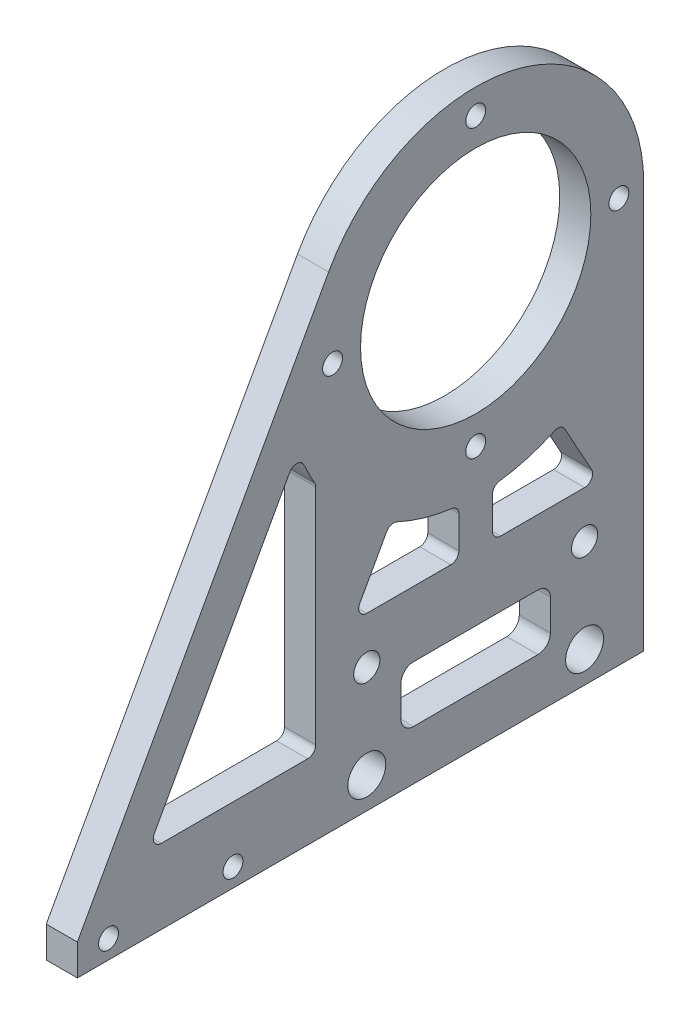
from build123d import *

# Parameters (mm, degrees)
SKETCH_1_R           = 27
SKETCH_1_R_2         = 18.5
EXTRUDE_1_DEPTH      = 5
SKETCH_2_R           = 1.6
CUT_EXTRUDE_1_DEPTH  = 10
EXTRUDE_2_DEPTH      = 5
SKETCH_9_W           = 91
SKETCH_9_H           = 135
CUT_EXTRUDE_5_DEPTH  = 211.049994049
SKETCH_13_R          = 2.1
SKETCH_13_R_2        = 3.0525
CUT_EXTRUDE_6_DEPTH  = 92.356444764
SKETCH_14_R          = 1.6
CUT_EXTRUDE_7_DEPTH  = 92.356444764
SKETCH_15_W          = 24
SKETCH_15_H          = 9
CUT_EXTRUDE_8_DEPTH  = 10
FILLET_1_R           = 2
CUT_EXTRUDE_9_DEPTH  = 92.356444764
FILLET_2_R           = 1.3
CUT_EXTRUDE_10_DEPTH = 92.356444764
FILLET_3_R           = 1.3


with BuildPart() as part:
    # 草图1 → 凸台-拉伸1 (new body)
    with BuildSketch(Plane(origin=(0, 0, 0), x_dir=(0, 0, -1), z_dir=(1, 0, 0))):
        Circle(SKETCH_1_R)
        Circle(SKETCH_1_R_2, mode=Mode.SUBTRACT)
    extrude(amount=EXTRUDE_1_DEPTH)

    # 草图2 → 切除-拉伸1 (cut)
    with BuildSketch(Plane(origin=(5, 0, 0), x_dir=(0, 0, -1), z_dir=(1, 0, 0))):
        with Locations((23, 0)):
            Circle(SKETCH_2_R)
        with Locations((0, -23)):
            Circle(SKETCH_2_R)
        with Locations((0, 23)):
            Circle(SKETCH_2_R)
        with Locations((-23, 0)):
            Circle(SKETCH_2_R)
    extrude(amount=-CUT_EXTRUDE_1_DEPTH, mode=Mode.SUBTRACT)

    # 草图3 → 凸台-拉伸2 (add)
    with BuildSketch(Plane.ZY):
        with BuildLine():
            ThreePointArc((27, 0), (0, -27), (-27, 0))
            Line((-27, 0), (-27, -200))
            Line((-27, -200), (64, -200))
            Line((64, -200), (64, -60))
            Line((64, -60), (23.632414536, 13.057908838))
            ThreePointArc((23.632414536, 13.057908838), (26.144551942, 6.742581388), (27, 0))
        make_face()
    extrude(amount=-EXTRUDE_2_DEPTH)

    # 草图9 → 切除-拉伸5 (cut, through all)
    with BuildSketch(Plane(origin=(5, 0, 0), x_dir=(0, 0, -1), z_dir=(1, 0, 0))):
        with Locations((-18.5, -132.5)):
            Rectangle(SKETCH_9_W, SKETCH_9_H)
    extrude(amount=-CUT_EXTRUDE_5_DEPTH, mode=Mode.SUBTRACT)

    # 草图13 → 切除-拉伸6 (cut, through all)
    with BuildSketch(Plane(origin=(5, 0, 0), x_dir=(0, 0, -1), z_dir=(1, 0, 0))):
        with Locations((-17.5, -45)):
            Circle(SKETCH_13_R)
        with Locations((-17.5, -60)):
            Circle(SKETCH_13_R_2)
        with Locations((17.5, -60)):
            Circle(SKETCH_13_R_2)
        with Locations((17.5, -45)):
            Circle(SKETCH_13_R)
    extrude(amount=-CUT_EXTRUDE_6_DEPTH, mode=Mode.SUBTRACT)

    # 草图14 → 切除-拉伸7 (cut, through all)
    with BuildSketch(Plane.ZY):
        with Locations((39, -62)):
            Circle(SKETCH_14_R)
        with Locations((59, -62)):
            Circle(SKETCH_14_R)
    extrude(amount=-CUT_EXTRUDE_7_DEPTH, mode=Mode.SUBTRACT)

    # 草图15 → 切除-拉伸8 (cut)
    with BuildSketch(Plane.ZY):
        with Locations((0, -52.5)):
            Rectangle(SKETCH_15_W, SKETCH_15_H)
    extrude(amount=-CUT_EXTRUDE_8_DEPTH, mode=Mode.SUBTRACT)

    # 圆角1
    fillet_1_edges = [part.edges().sort_by_distance(p)[0] for p in [
        (2.5, -57, -12),
        (2.5, -48, -12),
        (2.5, -48, 12),
        (2.5, -57, 12),
    ]]
    fillet(fillet_1_edges, radius=FILLET_1_R)

    # 草图16 → 切除-拉伸9 (cut, through all)
    with BuildSketch(Plane(origin=(5, 0, 0), x_dir=(0, 0, -1), z_dir=(1, 0, 0))):
        with BuildLine():
            Line((-28.536090226, -9.256973298), (-52.705963097, -53))
            Line((-52.705963097, -53), (-25.705963097, -53))
            Line((-25.705963097, -53), (-25.705963097, -15.466203841))
            ThreePointArc((-25.705963097, -15.466203841), (-27.29814505, -12.442317985), (-28.536090226, -9.256973298))
        make_face()
    extrude(amount=-CUT_EXTRUDE_9_DEPTH, mode=Mode.SUBTRACT)

    # 圆角2
    fillet_2_edges = [part.edges().sort_by_distance(p)[0] for p in [
        (2.5, -9.256973298, 28.536090226),
        (2.5, -15.466203841, 25.705963097),
        (2.5, -53, 25.705963097),
        (2.5, -53, 52.705963097),
    ]]
    fillet(fillet_2_edges, radius=FILLET_2_R)

    # 草图17 → 切除-拉伸10 (cut, through all)
    with BuildSketch(Plane(origin=(5, 0, 0), x_dir=(0, 0, -1), z_dir=(1, 0, 0))):
        with BuildLine():
            ThreePointArc((-2.7, -29.878252961), (-8.364759165, -28.81025519), (-13.720671758, -26.678515073))
            Line((-13.720671758, -26.678515073), (-19.7, -37.5))
            Line((-19.7, -37.5), (-2.7, -37.5))
            Line((-2.7, -37.5), (-2.7, -29.878252961))
        make_face()
        with BuildLine():
            Line((19.7, -37.5), (13.720671758, -26.678515073))
            ThreePointArc((13.720671758, -26.678515073), (8.364759165, -28.81025519), (2.7, -29.878252961))
            Line((2.7, -29.878252961), (2.7, -37.5))
            Line((2.7, -37.5), (19.7, -37.5))
        make_face()
    extrude(amount=-CUT_EXTRUDE_10_DEPTH, mode=Mode.SUBTRACT)

    # 圆角3
    fillet_3_edges = [part.edges().sort_by_distance(p)[0] for p in [
        (2.5, -26.678515073, 13.720671758),
        (2.5, -29.878252961, 2.7),
        (2.5, -37.5, 2.7),
        (2.5, -37.5, 19.7),
        (2.5, -29.878252961, -2.7),
        (2.5, -26.678515073, -13.720671758),
        (2.5, -37.5, -19.7),
        (2.5, -37.5, -2.7),
    ]]
    fillet(fillet_3_edges, radius=FILLET_3_R)


solid = part.part
